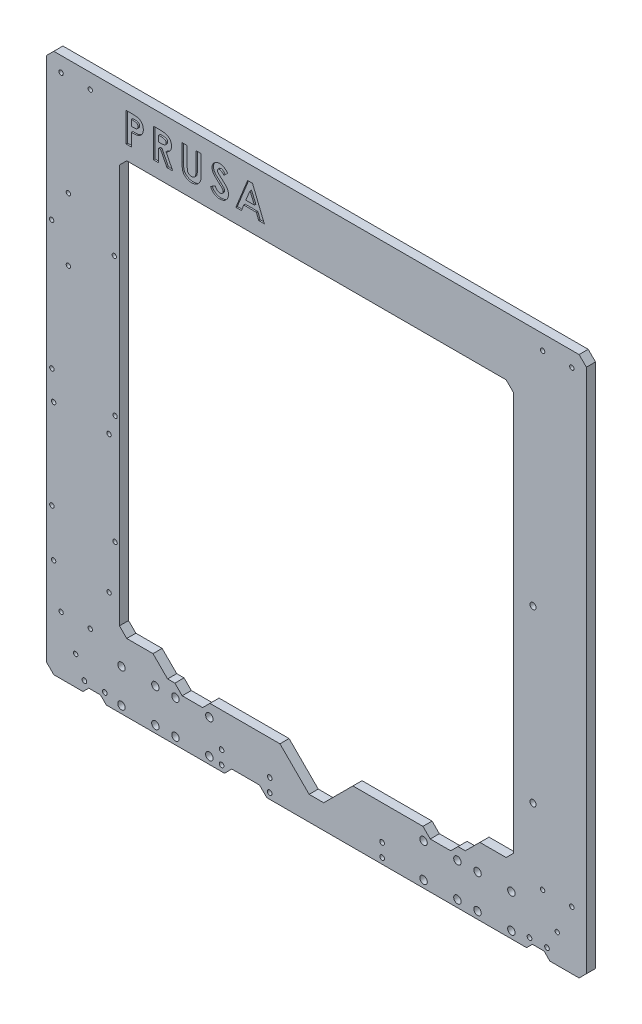
from build123d import *

# Parameters (mm, degrees)
SKETCH1_R           = 2.55
SKETCH1_R_2         = 1.5
SKETCH1_R_3         = 1.6
SKETCH1_R_4         = 2.1
BOSS_EXTRUDE1_DEPTH = 6.25
CUT_EXTRUDE1_DEPTH  = 1


with BuildPart() as part:
    # Sketch1 → Boss-Extrude1 (new body)
    with BuildSketch(Plane.XY):
        with BuildLine():
            add(Edge.make_bspline(
                [(5, 370), (2.5, 367.5), (0, 365)],
                knots=[1472.868668236, 1472.868668236, 1472.868668236, 1479.939736048, 1479.939736048, 1479.939736048], degree=2))
            add(Edge.make_bspline(
                [(0, 365), (0, 185), (0, 5)],
                knots=[0, 0, 0, 360.191742, 360.191742, 360.191742], degree=2))
            add(Edge.make_bspline(
                [(0, 5), (2.5, 2.5), (5, 0)],
                knots=[360.191742, 360.191742, 360.191742, 367.128552866, 367.128552866, 367.128552866], degree=2))
            add(Edge.make_bspline(
                [(5, 0), (15, 0), (25, 0)],
                knots=[367.128552866, 367.128552866, 367.128552866, 387.128552866, 387.128552866, 387.128552866], degree=2))
            add(Edge.make_bspline(
                [(25, 0), (27, 2), (29, 4)],
                knots=[387.128552866, 387.128552866, 387.128552866, 395.613834241, 395.613834241, 395.613834241], degree=2))
            add(Edge.make_bspline(
                [(29, 4), (33, 4), (37, 4)],
                knots=[395.613834241, 395.613834241, 395.613834241, 401.613834241, 401.613834241, 401.613834241], degree=2))
            add(Edge.make_bspline(
                [(37, 4), (39, 2), (41, 0)],
                knots=[401.613834241, 401.613834241, 401.613834241, 407.27068849, 407.27068849, 407.27068849], degree=2))
            add(Edge.make_bspline(
                [(41, 0), (81.5, 0), (122, 0)],
                knots=[407.27068849, 407.27068849, 407.27068849, 482.27068849, 482.27068849, 482.27068849], degree=2))
            add(Edge.make_bspline(
                [(122, 0), (124.5, 2.5), (127, 5)],
                knots=[482.27068849, 482.27068849, 482.27068849, 487.92754274, 487.92754274, 487.92754274], degree=2))
            add(Edge.make_bspline(
                [(127, 5), (136.5, 5), (146, 5)],
                knots=[487.92754274, 487.92754274, 487.92754274, 501.92754274, 501.92754274, 501.92754274], degree=2))
            add(Edge.make_bspline(
                [(146, 5), (148.5, 2.5), (151, 0)],
                knots=[501.92754274, 501.92754274, 501.92754274, 507.584396989, 507.584396989, 507.584396989], degree=2))
            add(Edge.make_bspline(
                [(151, 0), (240, 0), (329, 0)],
                knots=[507.584396989, 507.584396989, 507.584396989, 698.584396989, 698.584396989, 698.584396989], degree=2))
            add(Edge.make_bspline(
                [(329, 0), (331, 2), (333, 4)],
                knots=[698.584396989, 698.584396989, 698.584396989, 704.241251238, 704.241251238, 704.241251238], degree=2))
            add(Edge.make_bspline(
                [(333, 4), (337, 4), (341, 4)],
                knots=[704.241251238, 704.241251238, 704.241251238, 710.241251238, 710.241251238, 710.241251238], degree=2))
            add(Edge.make_bspline(
                [(341, 4), (343, 2), (345, 0)],
                knots=[710.241251238, 710.241251238, 710.241251238, 718.726532613, 718.726532613, 718.726532613], degree=2))
            add(Edge.make_bspline(
                [(345, 0), (355, 0), (365, 0)],
                knots=[718.726532613, 718.726532613, 718.726532613, 738.726532613, 738.726532613, 738.726532613], degree=2))
            add(Edge.make_bspline(
                [(365, 0), (367.5, 2.5), (370, 5)],
                knots=[738.726532613, 738.726532613, 738.726532613, 745.797600425, 745.797600425, 745.797600425], degree=2))
            add(Edge.make_bspline(
                [(370, 5), (370, 185), (370, 365)],
                knots=[745.797600425, 745.797600425, 745.797600425, 1105.797600425, 1105.797600425, 1105.797600425], degree=2))
            add(Edge.make_bspline(
                [(370, 365), (367.5, 367.5), (365, 370)],
                knots=[1105.797600425, 1105.797600425, 1105.797600425, 1112.868668236, 1112.868668236, 1112.868668236], degree=2))
            add(Edge.make_bspline(
                [(365, 370), (185, 370), (5, 370)],
                knots=[1112.868668236, 1112.868668236, 1112.868668236, 1472.868668236, 1472.868668236, 1472.868668236], degree=2))
        make_face()
        with Locations((318.6, 4.9)):
            Circle(SKETCH1_R, mode=Mode.SUBTRACT)
        with Locations((318.6, 28.1)):
            Circle(SKETCH1_R, mode=Mode.SUBTRACT)
        with Locations((295.4, 28.1)):
            Circle(SKETCH1_R, mode=Mode.SUBTRACT)
        with Locations((295.4, 4.9)):
            Circle(SKETCH1_R, mode=Mode.SUBTRACT)
        with Locations((281.6, 4.9)):
            Circle(SKETCH1_R, mode=Mode.SUBTRACT)
        with Locations((258.4, 4.9)):
            Circle(SKETCH1_R, mode=Mode.SUBTRACT)
        with Locations((258.4, 28.1)):
            Circle(SKETCH1_R, mode=Mode.SUBTRACT)
        with Locations((281.6, 28.1)):
            Circle(SKETCH1_R, mode=Mode.SUBTRACT)
        with Locations((111.6, 4.9)):
            Circle(SKETCH1_R, mode=Mode.SUBTRACT)
        with Locations((111.6, 28.1)):
            Circle(SKETCH1_R, mode=Mode.SUBTRACT)
        with Locations((88.4, 28.1)):
            Circle(SKETCH1_R, mode=Mode.SUBTRACT)
        with Locations((88.4, 4.9)):
            Circle(SKETCH1_R, mode=Mode.SUBTRACT)
        with Locations((74.6, 4.9)):
            Circle(SKETCH1_R, mode=Mode.SUBTRACT)
        with Locations((74.6, 28.1)):
            Circle(SKETCH1_R, mode=Mode.SUBTRACT)
        with Locations((51.4, 28.1)):
            Circle(SKETCH1_R, mode=Mode.SUBTRACT)
        with Locations((51.4, 4.9)):
            Circle(SKETCH1_R, mode=Mode.SUBTRACT)
        with Locations((360, 39.8)):
            Circle(SKETCH1_R_2, mode=Mode.SUBTRACT)
        with Locations((10, 39.8)):
            Circle(SKETCH1_R_2, mode=Mode.SUBTRACT)
        with Locations((340, 359.8)):
            Circle(SKETCH1_R_2, mode=Mode.SUBTRACT)
        with Locations((30, 39.8)):
            Circle(SKETCH1_R_2, mode=Mode.SUBTRACT)
        with Locations((42.9, 67.8)):
            Circle(SKETCH1_R_2, mode=Mode.SUBTRACT)
        with Locations((340, 39.8)):
            Circle(SKETCH1_R_2, mode=Mode.SUBTRACT)
        with Locations((10, 359.8)):
            Circle(SKETCH1_R_2, mode=Mode.SUBTRACT)
        with Locations((350, 19.8)):
            Circle(SKETCH1_R_2, mode=Mode.SUBTRACT)
        with Locations((47, 99.8)):
            Circle(SKETCH1_R_2, mode=Mode.SUBTRACT)
        with Locations((3.7, 181.1)):
            Circle(SKETCH1_R_2, mode=Mode.SUBTRACT)
        with Locations((20, 19.8)):
            Circle(SKETCH1_R_2, mode=Mode.SUBTRACT)
        with Locations((4.9, 67.8)):
            Circle(SKETCH1_R_2, mode=Mode.SUBTRACT)
        with Locations((360, 359.8)):
            Circle(SKETCH1_R_2, mode=Mode.SUBTRACT)
        with Locations((42.9, 161.8)):
            Circle(SKETCH1_R_2, mode=Mode.SUBTRACT)
        with Locations((3.7, 99.8)):
            Circle(SKETCH1_R_2, mode=Mode.SUBTRACT)
        with Locations((30, 359.8)):
            Circle(SKETCH1_R_2, mode=Mode.SUBTRACT)
        with Locations((47, 174.7)):
            Circle(SKETCH1_R_2, mode=Mode.SUBTRACT)
        with Locations((4.9, 161.8)):
            Circle(SKETCH1_R_2, mode=Mode.SUBTRACT)
        with Locations((46.5, 269.3)):
            Circle(SKETCH1_R_2, mode=Mode.SUBTRACT)
        with Locations((15, 247.8)):
            Circle(SKETCH1_R_2, mode=Mode.SUBTRACT)
        with Locations((3.5, 269.3)):
            Circle(SKETCH1_R_2, mode=Mode.SUBTRACT)
        with Locations((15, 290.8)):
            Circle(SKETCH1_R_2, mode=Mode.SUBTRACT)
        with Locations((40, 7)):
            Circle(SKETCH1_R_3, mode=Mode.SUBTRACT)
        with Locations((331, 7)):
            Circle(SKETCH1_R_3, mode=Mode.SUBTRACT)
        with Locations((343, 7)):
            Circle(SKETCH1_R_3, mode=Mode.SUBTRACT)
        with Locations((120, 13)):
            Circle(SKETCH1_R_3, mode=Mode.SUBTRACT)
        with Locations((120, 4)):
            Circle(SKETCH1_R_3, mode=Mode.SUBTRACT)
        with Locations((230, 13)):
            Circle(SKETCH1_R_3, mode=Mode.SUBTRACT)
        with Locations((230, 4)):
            Circle(SKETCH1_R_3, mode=Mode.SUBTRACT)
        with Locations((333.4, 205)):
            Circle(SKETCH1_R_4, mode=Mode.SUBTRACT)
        with Locations((333.4, 88)):
            Circle(SKETCH1_R_4, mode=Mode.SUBTRACT)
        with Locations((26, 7)):
            Circle(SKETCH1_R_3, mode=Mode.SUBTRACT)
        with Locations((153, 13)):
            Circle(SKETCH1_R_3, mode=Mode.SUBTRACT)
        with Locations((153, 4)):
            Circle(SKETCH1_R_3, mode=Mode.SUBTRACT)
        with BuildLine():
            add(Edge.make_bspline(
                [(93, 31.5), (100, 31.5), (107, 31.5)],
                knots=[1110.421356237, 1110.421356237, 1110.421356237, 1117.046356237, 1117.046356237, 1117.046356237], degree=2))
            add(Edge.make_bspline(
                [(107, 31.5), (109.5, 34), (112, 36.5)],
                knots=[0, 0, 0, 7.071067812, 7.071067812, 7.071067812], degree=2))
            add(Edge.make_bspline(
                [(112, 36.5), (134.25, 36.5), (156.5, 36.5), (158.25, 36.5), (160, 36.5)],
                knots=[7.071067812, 7.071067812, 7.071067812, 51.571067812, 51.571067812, 55.071067812, 55.071067812, 55.071067812], degree=2))
            add(Edge.make_bspline(
                [(160, 36.5), (170, 26.5), (180, 16.5)],
                knots=[55.071067812, 55.071067812, 55.071067812, 83.355339059, 83.355339059, 83.355339059], degree=2))
            add(Edge.make_bspline(
                [(180, 16.5), (185, 16.5), (190, 16.5)],
                knots=[83.355339059, 83.355339059, 83.355339059, 93.355339059, 93.355339059, 93.355339059], degree=2))
            add(Edge.make_bspline(
                [(190, 16.5), (200, 26.5), (210, 36.5)],
                knots=[93.355339059, 93.355339059, 93.355339059, 121.639610307, 121.639610307, 121.639610307], degree=2))
            add(Edge.make_bspline(
                [(210, 36.5), (211.75, 36.5), (213.5, 36.5), (235.75, 36.5), (258, 36.5)],
                knots=[121.639610307, 121.639610307, 121.639610307, 125.139610307, 125.139610307, 169.639610307, 169.639610307, 169.639610307], degree=2))
            add(Edge.make_bspline(
                [(258, 36.5), (260.5, 34), (263, 31.5)],
                knots=[169.639610307, 169.639610307, 169.639610307, 176.710678119, 176.710678119, 176.710678119], degree=2))
            add(Edge.make_bspline(
                [(263, 31.5), (264, 31.5), (265, 31.5), (270, 31.5), (275, 31.5), (276, 31.5), (277, 31.5)],
                knots=[176.710678119, 176.710678119, 176.710678119, 178.710678119, 178.710678119, 188.710678119, 188.710678119, 190.710678119, 190.710678119, 190.710678119], degree=2))
            add(Edge.make_bspline(
                [(277, 31.5), (279.5, 34), (282, 36.5)],
                knots=[190.710678119, 190.710678119, 190.710678119, 197.781745931, 197.781745931, 197.781745931], degree=2))
            add(Edge.make_bspline(
                [(282, 36.5), (284.5, 36.5), (287, 36.5)],
                knots=[197.781745931, 197.781745931, 197.781745931, 202.781745931, 202.781745931, 202.781745931], degree=2))
            add(Edge.make_bspline(
                [(287, 36.5), (292, 41.5), (297, 46.5)],
                knots=[202.781745931, 202.781745931, 202.781745931, 216.923881554, 216.923881554, 216.923881554], degree=2))
            add(Edge.make_bspline(
                [(297, 46.5), (306, 46.5), (315, 46.5)],
                knots=[216.923881554, 216.923881554, 216.923881554, 234.923881554, 234.923881554, 234.923881554], degree=2))
            add(Edge.make_bspline(
                [(315, 46.5), (317.5, 49), (320, 51.5)],
                knots=[234.923881554, 234.923881554, 234.923881554, 241.994949366, 241.994949366, 241.994949366], degree=2))
            add(Edge.make_bspline(
                [(320, 51.5), (320, 188.25), (320, 325)],
                knots=[241.994949366, 241.994949366, 241.994949366, 513.494949366, 513.494949366, 513.494949366], degree=2))
            add(Edge.make_bspline(
                [(320, 325), (317.5, 327.5), (315, 330)],
                knots=[513.494949366, 513.494949366, 513.494949366, 520.566017178, 520.566017178, 520.566017178], degree=2))
            add(Edge.make_bspline(
                [(315, 330), (185, 330), (55, 330)],
                knots=[520.566017178, 520.566017178, 520.566017178, 780.566017178, 780.566017178, 780.566017178], degree=2))
            add(Edge.make_bspline(
                [(55, 330), (52.5, 327.5), (50, 325)],
                knots=[780.566017178, 780.566017178, 780.566017178, 787.63708499, 787.63708499, 787.63708499], degree=2))
            add(Edge.make_bspline(
                [(50, 325), (50, 188.25), (50, 51.5)],
                knots=[787.63708499, 787.63708499, 787.63708499, 1059.13708499, 1059.13708499, 1059.13708499], degree=2))
            add(Edge.make_bspline(
                [(50, 51.5), (52.5, 49), (55, 46.5)],
                knots=[1059.13708499, 1059.13708499, 1059.13708499, 1066.208152802, 1066.208152802, 1066.208152802], degree=2))
            add(Edge.make_bspline(
                [(55, 46.5), (64, 46.5), (73, 46.5)],
                knots=[1066.208152802, 1066.208152802, 1066.208152802, 1084.208152802, 1084.208152802, 1084.208152802], degree=2))
            add(Edge.make_bspline(
                [(73, 46.5), (78, 41.5), (83, 36.5)],
                knots=[1084.208152802, 1084.208152802, 1084.208152802, 1098.350288425, 1098.350288425, 1098.350288425], degree=2))
            add(Edge.make_bspline(
                [(83, 36.5), (85.5, 36.5), (88, 36.5)],
                knots=[1098.350288425, 1098.350288425, 1098.350288425, 1103.350288425, 1103.350288425, 1103.350288425], degree=2))
            add(Edge.make_bspline(
                [(88, 36.5), (90.5, 34), (93, 31.5)],
                knots=[1103.350288425, 1103.350288425, 1103.350288425, 1110.421356237, 1110.421356237, 1110.421356237], degree=2))
        make_face(mode=Mode.SUBTRACT)
    extrude(amount=BOSS_EXTRUDE1_DEPTH)

    # Sketch2 → Cut-Extrude1 (cut)
    # profile 1 of 5: a face of its own
    with BuildSketch(Plane.XY.offset(6.25)):
        with BuildLine():
            Line((54.564407773, 359.746059065), (58.57081803, 359.746059065))
            add(Edge.make_bspline(
                [(58.57081803, 359.746059065), (58.832591679, 359.744887311), (59.337607918, 359.742626751), (60.065882885, 359.715214451), (60.7377522, 359.666089942), (61.353061503, 359.605379816), (61.911557793, 359.520266583), (62.413940476, 359.422690925), (62.860313807, 359.303815374), (63.25571131, 359.162711743), (63.610567798, 358.996356076), (63.946376486, 358.819175415), (64.255548063, 358.607716545), (64.553687352, 358.384769606), (64.823749214, 358.129036561), (65.082581726, 357.857536815), (65.319222626, 357.559502914), (65.534768419, 357.238542475), (65.730301665, 356.900585477), (65.901132591, 356.545027751), (66.039701071, 356.171306666), (66.155942795, 355.781839771), (66.249309281, 355.376644041), (66.311456986, 354.953227485), (66.353670833, 354.51454656), (66.357395623, 354.215980045), (66.359279568, 354.064969322)],
                knots=[0, 0, 0, 0, 1.698747864, 3.27724071, 4.728299578, 6.070144658, 7.288476769, 8.393259625, 9.389771311, 10.283485332, 11.113357557, 11.931608583, 12.74405601, 13.541433047, 14.344816069, 15.154114104, 15.974336324, 16.810834471, 17.661136416, 18.50621059, 19.367396281, 20.244825668, 21.142564693, 22.063065223, 23.020325768, 24, 24, 24, 24], degree=3))
            add(Edge.make_bspline(
                [(66.359279568, 354.064969322), (66.356553735, 353.897909754), (66.351197137, 353.569617176), (66.298685215, 353.088380532), (66.208978262, 352.629564962), (66.091735966, 352.189301194), (65.928249922, 351.774832541), (65.741474794, 351.376269654), (65.511682144, 351.004787013), (65.249107305, 350.655737818), (64.962345625, 350.326284134), (64.644589394, 350.025938314), (64.301895182, 349.752652909), (63.936246724, 349.503563869), (63.546271266, 349.27917366), (63.132250194, 349.077381106), (62.691356337, 348.904640161), (62.38433112, 348.814298045), (62.228670594, 348.768494963)],
                knots=[0, 0, 0, 0, 1.102006807, 2.165578795, 3.188629044, 4.184801286, 5.166646146, 6.124351954, 7.085497154, 8.042432466, 9.003981491, 9.963833307, 10.922997304, 11.89326795, 12.880200226, 13.889073926, 14.929769137, 16, 16, 16, 16], degree=3))
            add(Edge.make_bspline(
                [(62.228670594, 348.768494963), (62.126143617, 348.742986085), (61.90403717, 348.687725642), (61.536512005, 348.631622422), (61.112977841, 348.58003896), (60.632065114, 348.53570922), (60.093496568, 348.505575326), (59.497793676, 348.482042095), (58.844686477, 348.464931006), (58.390541557, 348.464323829), (58.154151363, 348.464007783)],
                knots=[0, 0, 0, 0, 0.618981996, 1.340914327, 2.176866532, 3.120127938, 4.170906482, 5.338178032, 6.614476169, 8, 8, 8, 8], degree=3))
            Line((58.154151363, 348.464007783), (58.154151363, 339.746059065))
            Line((58.154151363, 339.746059065), (54.564407773, 339.746059065))
            Line((54.564407773, 339.746059065), (54.564407773, 359.746059065))
        make_face()
        with BuildLine():
            Line((58.154151363, 352.053751373), (59.424183414, 352.053751373))
            add(Edge.make_bspline(
                [(59.424183414, 352.053751373), (59.655285797, 352.055216742), (60.080517614, 352.057913041), (60.661234114, 352.096903103), (61.127909063, 352.156448804), (61.496590939, 352.241851109), (61.787700201, 352.371460415), (62.038763713, 352.521393976), (62.254107297, 352.710980848), (62.440563146, 352.927616288), (62.589628978, 353.176541267), (62.692998368, 353.453702524), (62.760145092, 353.753276605), (62.766346715, 353.961760337), (62.769535979, 354.068975732)],
                knots=[0, 0, 0, 0, 1.8619151, 3.425951444, 4.686033666, 5.651700536, 6.461346321, 7.243864085, 7.999046032, 8.762387399, 9.539336099, 10.322741239, 11.137448474, 12, 12, 12, 12], degree=3))
            add(Edge.make_bspline(
                [(62.769535979, 354.068975732), (62.766379521, 354.162648427), (62.760255235, 354.344395977), (62.71526456, 354.606702771), (62.643562367, 354.851226815), (62.539668645, 355.075414379), (62.405358664, 355.278884532), (62.241607617, 355.46155712), (62.050516752, 355.62734423), (61.902983431, 355.71509788), (61.828029568, 355.75968086)],
                knots=[0, 0, 0, 0, 1.102301479, 2.1387299, 3.123554645, 4.094223062, 5.036071848, 5.982632524, 6.975082478, 8, 8, 8, 8], degree=3))
            add(Edge.make_bspline(
                [(61.828029568, 355.75968086), (61.76453932, 355.791789699), (61.630117453, 355.859770692), (61.401183982, 355.938803566), (61.136998252, 356.005476502), (60.835776712, 356.060814395), (60.498721021, 356.103762347), (60.125891316, 356.136606786), (59.716738942, 356.149814814), (59.432197947, 356.154088822), (59.283959055, 356.156315476)],
                knots=[0, 0, 0, 0, 0.656809284, 1.390599849, 2.23162475, 3.173112763, 4.218524733, 5.370385145, 6.63003504, 8, 8, 8, 8], degree=3))
            Line((59.283959055, 356.156315476), (58.154151363, 356.156315476))
            Line((58.154151363, 356.156315476), (58.154151363, 352.053751373))
        make_face(mode=Mode.SUBTRACT)
    # profile 2 of 5: a face of its own
    with BuildSketch(Plane.XY.offset(6.25)):
        with BuildLine():
            Line((73.333638543, 359.746059065), (77.51633085, 359.746059065))
            add(Edge.make_bspline(
                [(77.51633085, 359.746059065), (77.792805539, 359.745077739), (78.324544243, 359.743190372), (79.091282412, 359.713412716), (79.795636864, 359.671974665), (80.438650459, 359.608739098), (81.020048106, 359.52489638), (81.5404125, 359.42605969), (81.999728433, 359.313414092), (82.4018696, 359.173048789), (82.764782117, 359.014718855), (83.103067038, 358.832794858), (83.424187431, 358.629302579), (83.725996952, 358.398887586), (84.011118397, 358.145694986), (84.280089666, 357.869469917), (84.529109945, 357.567870105), (84.756637289, 357.242801277), (84.964010149, 356.900836323), (85.147284264, 356.541505726), (85.296323078, 356.164559592), (85.428014848, 355.77544561), (85.522868163, 355.368601318), (85.588837256, 354.947987415), (85.637137245, 354.512123294), (85.639914263, 354.216016563), (85.64133085, 354.064969322)],
                knots=[0, 0, 0, 0, 1.749336639, 3.364467119, 4.854658419, 6.213483162, 7.451590619, 8.570285859, 9.5643256, 10.440900261, 11.26203566, 12.067320669, 12.869050712, 13.665104639, 14.467235401, 15.27997916, 16.102287765, 16.939272006, 17.78853747, 18.631303466, 19.488103222, 20.351255419, 21.228522269, 22.127379805, 23.044756219, 24, 24, 24, 24], degree=3))
            add(Edge.make_bspline(
                [(85.64133085, 354.064969322), (85.637651066, 353.907310701), (85.630435681, 353.598170881), (85.591569689, 353.144069699), (85.520534866, 352.70961745), (85.412942291, 352.296086159), (85.289278601, 351.898328945), (85.124837616, 351.523684678), (84.939249711, 351.166704701), (84.718832378, 350.832438629), (84.476935124, 350.513461746), (84.195613706, 350.22199524), (83.89309343, 349.94237389), (83.552368531, 349.692112227), (83.188458477, 349.454288463), (82.794132761, 349.238756799), (82.371964885, 349.040099263), (82.075159962, 348.929314099), (81.923382132, 348.872661629)],
                knots=[0, 0, 0, 0, 1.099860209, 2.156625411, 3.176576793, 4.16617041, 5.135385252, 6.078461593, 7.016046972, 7.938469504, 8.868247731, 9.803980173, 10.76021508, 11.73834243, 12.748633912, 13.790971185, 14.870363756, 16, 16, 16, 16], degree=3))
            Line((81.923382132, 348.872661629), (86.538766748, 339.746059065))
            Line((86.538766748, 339.746059065), (82.548382132, 339.746059065))
            Line((82.548382132, 339.746059065), (78.14133085, 348.464007783))
            Line((78.14133085, 348.464007783), (76.923382132, 348.464007783))
            Line((76.923382132, 348.464007783), (76.923382132, 339.746059065))
            Line((76.923382132, 339.746059065), (73.333638543, 339.746059065))
            Line((73.333638543, 339.746059065), (73.333638543, 359.746059065))
        make_face()
        with BuildLine():
            Line((76.923382132, 352.053751373), (78.321619312, 352.053751373))
            add(Edge.make_bspline(
                [(78.321619312, 352.053751373), (78.49256543, 352.055676683), (78.819890514, 352.059363238), (79.290626977, 352.076463009), (79.718167949, 352.117665007), (80.104349437, 352.169722191), (80.451114671, 352.229829728), (80.755370626, 352.315967477), (81.021805424, 352.408266257), (81.2472618, 352.522969697), (81.439886548, 352.653412386), (81.606205689, 352.801598525), (81.743775466, 352.973105111), (81.857002409, 353.163271335), (81.945080661, 353.373779172), (82.009371037, 353.602317722), (82.04529985, 353.851490333), (82.049433583, 354.023453362), (82.051587261, 354.113046245)],
                knots=[0, 0, 0, 0, 1.688639943, 3.233382647, 4.650958383, 5.928841754, 7.082724185, 8.122798841, 9.049171256, 9.863274652, 10.613301712, 11.341792392, 12.054588806, 12.776240173, 13.521029143, 14.301969904, 15.115324896, 16, 16, 16, 16], degree=3))
            add(Edge.make_bspline(
                [(82.051587261, 354.113046245), (82.047515535, 354.219041166), (82.039517385, 354.427248546), (81.960150885, 354.726994166), (81.833816561, 355.004429246), (81.660646805, 355.258300265), (81.442562011, 355.480861125), (81.192292504, 355.677050296), (80.904436863, 355.832182013), (80.637904201, 355.934505241), (80.395421778, 355.995726285), (80.176589042, 356.041347665), (79.923179415, 356.073680846), (79.635001589, 356.10797594), (79.312790137, 356.130214573), (78.954788815, 356.146444342), (78.5620258, 356.153084738), (78.288232676, 356.155207556), (78.145337261, 356.156315476)],
                knots=[0, 0, 0, 0, 1.020303359, 2.004196876, 2.966617323, 3.9489082, 4.950758222, 5.960522915, 7.003732012, 8.091992268, 8.70421221, 9.413913587, 10.24622431, 11.166358409, 12.212345909, 13.359657661, 14.621978493, 16, 16, 16, 16], degree=3))
            Line((78.145337261, 356.156315476), (76.923382132, 356.156315476))
            Line((76.923382132, 356.156315476), (76.923382132, 352.053751373))
        make_face(mode=Mode.SUBTRACT)
    # profile 3 of 5: a face of its own
    with BuildSketch(Plane.XY.offset(6.25)):
        with BuildLine():
            Line((92.872100081, 359.746059065), (96.461843671, 359.746059065))
            Line((96.461843671, 359.746059065), (96.461843671, 346.733238553))
            add(Edge.make_bspline(
                [(96.461843671, 346.733238553), (96.462038863, 346.598327274), (96.462415876, 346.337747532), (96.481289313, 345.963900918), (96.498559809, 345.620257604), (96.529720687, 345.307193807), (96.575755984, 345.024575609), (96.620333172, 344.770587571), (96.680663989, 344.549777061), (96.771331561, 344.298436892), (96.911020527, 344.016042484), (97.139264545, 343.721724553), (97.402638617, 343.453116723), (97.718307612, 343.229537742), (98.073091645, 343.048682498), (98.465041336, 342.914688777), (98.893604176, 342.84020606), (99.189931871, 342.828834909), (99.342452645, 342.822982142)],
                knots=[0, 0, 0, 0, 1.155499968, 2.231836252, 3.205919964, 4.102923608, 4.924856345, 5.658536265, 6.31071849, 6.882491295, 7.94666036, 8.992281882, 10.060072772, 11.158554251, 12.289267114, 13.461410017, 14.693379945, 16, 16, 16, 16], degree=3))
            add(Edge.make_bspline(
                [(99.342452645, 342.822982142), (99.504487146, 342.827710426), (99.820426989, 342.836929779), (100.274856156, 342.927427711), (100.695887356, 343.071531411), (101.074605924, 343.277204116), (101.410634973, 343.523738898), (101.695076521, 343.804865807), (101.919556746, 344.12114555), (102.065864605, 344.412937697), (102.148009263, 344.681506959), (102.209580776, 344.921463403), (102.254719507, 345.204588255), (102.295670846, 345.52645991), (102.320279447, 345.890412337), (102.346963463, 346.293518585), (102.356743402, 346.738536815), (102.358410321, 347.04841136), (102.359279568, 347.210001373)],
                knots=[0, 0, 0, 0, 1.261321664, 2.459363699, 3.594844139, 4.716940403, 5.803436589, 6.833651888, 7.818396249, 8.814403945, 9.360733334, 10.004355033, 10.743453831, 11.592799886, 12.532235708, 13.585170094, 14.740740724, 16, 16, 16, 16], degree=3))
            Line((102.359279568, 347.210001373), (102.359279568, 359.746059065))
            Line((102.359279568, 359.746059065), (105.949023158, 359.746059065))
            Line((105.949023158, 359.746059065), (105.949023158, 347.814969322))
            add(Edge.make_bspline(
                [(105.949023158, 347.814969322), (105.948524657, 347.573246014), (105.947566088, 347.108435667), (105.932845357, 346.440470489), (105.901507583, 345.830391445), (105.875187467, 345.278020272), (105.82424903, 344.784101105), (105.771183129, 344.346524768), (105.703546072, 343.966841933), (105.602906198, 343.534619167), (105.429231569, 343.036930481), (105.149245299, 342.463863533), (104.793820852, 341.902796279), (104.373726917, 341.359900846), (103.899402437, 340.855568484), (103.381364202, 340.41282995), (102.827842551, 340.038320892), (102.233053579, 339.741198508), (101.597503483, 339.509465448), (100.914903968, 339.353752504), (100.185720513, 339.248550884), (99.682059719, 339.238444974), (99.42258085, 339.233238553)],
                knots=[0, 0, 0, 0, 1.170808336, 2.251350247, 3.235597562, 4.129743112, 4.929140599, 5.639994148, 6.264258765, 6.79612947, 7.788252245, 8.809469599, 9.879094798, 10.999557536, 12.129761673, 13.226370002, 14.293821979, 15.358369427, 16.438775801, 17.562147481, 18.744053101, 20, 20, 20, 20], degree=3))
            add(Edge.make_bspline(
                [(99.42258085, 339.233238553), (99.250177928, 339.236142452), (98.910030499, 339.241871786), (98.409784033, 339.292389548), (97.926197556, 339.366833734), (97.460179723, 339.475440135), (97.010113075, 339.61573932), (96.576117182, 339.788437846), (96.15980488, 339.992572422), (95.763505792, 340.226265453), (95.387707599, 340.478964236), (95.044247449, 340.759091475), (94.721306072, 341.045930702), (94.428213109, 341.351553329), (94.162767172, 341.672750841), (93.925514947, 342.010251176), (93.716808911, 342.364024355), (93.531399179, 342.74044712), (93.372706544, 343.158651682), (93.238922692, 343.633513747), (93.12204597, 344.172476306), (93.035190086, 344.776753612), (92.956446032, 345.444354034), (92.906605388, 346.177016774), (92.880531503, 346.974762852), (92.874981571, 347.52782367), (92.872100081, 347.814969322)],
                knots=[0, 0, 0, 0, 1.001158378, 1.975264943, 2.917723546, 3.841610987, 4.75185031, 5.653588123, 6.552117133, 7.442167995, 8.324307438, 9.179605724, 10.014504199, 10.831958861, 11.636465792, 12.43274043, 13.225645099, 14.020104002, 14.867201867, 15.819789774, 16.883317127, 18.068162734, 19.364263498, 20.787406516, 22.332041935, 24, 24, 24, 24], degree=3))
            Line((92.872100081, 347.814969322), (92.872100081, 359.746059065))
        make_face()
    # profile 4 of 5: a face of its own
    with BuildSketch(Plane.XY.offset(6.25)):
        with BuildLine():
            Line((124.205433414, 357.073783424), (121.521138543, 354.617853937))
            add(Edge.make_bspline(
                [(121.521138543, 354.617853937), (121.40615486, 354.780050375), (121.185402225, 355.091444916), (120.827585229, 355.508409547), (120.47138396, 355.864111406), (120.11349843, 356.157064538), (119.750756478, 356.385489032), (119.383787771, 356.547216098), (119.014672757, 356.650027528), (118.766684445, 356.662830025), (118.644535979, 356.669135988)],
                knots=[0, 0, 0, 0, 1.299362458, 2.494594718, 3.587462134, 4.587049575, 5.512617175, 6.380583204, 7.202344345, 8, 8, 8, 8], degree=3))
            add(Edge.make_bspline(
                [(118.644535979, 356.669135988), (118.530599392, 356.66514024), (118.310617779, 356.657425501), (117.997017669, 356.580741564), (117.718599026, 356.448396351), (117.475633573, 356.275343851), (117.283169087, 356.066855708), (117.129501121, 355.848205253), (117.042973143, 355.6068646), (117.031584359, 355.441102103), (117.025946235, 355.359039835)],
                knots=[0, 0, 0, 0, 1.185010067, 2.2879431, 3.333075148, 4.379039566, 5.372662701, 6.27520591, 7.14612461, 8, 8, 8, 8], degree=3))
            add(Edge.make_bspline(
                [(117.025946235, 355.359039835), (117.029479361, 355.275794191), (117.036594587, 355.108149035), (117.10531798, 354.862444179), (117.208903757, 354.622361933), (117.307884196, 354.476212446), (117.358478286, 354.401507783)],
                knots=[0, 0, 0, 0, 0.967525499, 1.948461899, 2.951351359, 4, 4, 4, 4], degree=3))
            add(Edge.make_bspline(
                [(117.358478286, 354.401507783), (117.404473787, 354.343440631), (117.510349355, 354.209777715), (117.712232379, 353.998076491), (117.965755057, 353.738723962), (118.280673478, 353.4406385), (118.64391451, 353.093099786), (119.072314845, 352.709769701), (119.553543253, 352.278776956), (119.895589256, 351.978649215), (120.07482444, 351.821379578)],
                knots=[0, 0, 0, 0, 0.473873513, 1.090794244, 1.870441696, 2.795289791, 3.865433203, 5.087734844, 6.473946851, 8, 8, 8, 8], degree=3))
            add(Edge.make_bspline(
                [(120.07482444, 351.821379578), (120.243062443, 351.675778073), (120.562343219, 351.399456666), (121.016616361, 351.007262794), (121.415846794, 350.654415531), (121.765850394, 350.346210358), (122.06132145, 350.079413498), (122.303502121, 349.852749665), (122.495350235, 349.670631587), (122.604404654, 349.560632157), (122.650946235, 349.513687271)],
                knots=[0, 0, 0, 0, 1.543621617, 2.929473131, 4.163658386, 5.240097082, 6.164993805, 6.925417477, 7.541396219, 8, 8, 8, 8], degree=3))
            add(Edge.make_bspline(
                [(122.650946235, 349.513687271), (122.827515289, 349.322601738), (123.16694302, 348.955268239), (123.608079413, 348.38601684), (123.971148934, 347.830311401), (124.2520264, 347.277695424), (124.46415636, 346.72019576), (124.613710792, 346.14413976), (124.703279936, 345.543508), (124.713224202, 345.133650147), (124.718253927, 344.926347527)],
                knots=[0, 0, 0, 0, 1.206664779, 2.319633467, 3.337109185, 4.282041471, 5.190008762, 6.099243693, 7.03861361, 8, 8, 8, 8], degree=3))
            add(Edge.make_bspline(
                [(124.718253927, 344.926347527), (124.714673898, 344.724356547), (124.707649746, 344.328042728), (124.621617359, 343.748096486), (124.498940226, 343.193062762), (124.309259855, 342.668981108), (124.078078544, 342.167248884), (123.78825938, 341.695681482), (123.447906513, 341.249506447), (123.057809868, 340.836699704), (122.626316657, 340.462106197), (122.16349918, 340.128634209), (121.664831774, 339.853310607), (121.134574976, 339.626601259), (120.573012619, 339.451986688), (119.980813694, 339.322930246), (119.357072392, 339.245472604), (118.930549102, 339.237375326), (118.712644953, 339.233238553)],
                knots=[0, 0, 0, 0, 1.043214005, 2.046824704, 3.02475056, 3.976699089, 4.921714032, 5.875962561, 6.831408892, 7.817874052, 8.806269674, 9.781291748, 10.760897367, 11.74438705, 12.757449933, 13.795994037, 14.874007457, 16, 16, 16, 16], degree=3))
            add(Edge.make_bspline(
                [(118.712644953, 339.233238553), (118.541592051, 339.236273145), (118.202809207, 339.242283378), (117.703494513, 339.291351931), (117.221349732, 339.370543354), (116.756917956, 339.48404832), (116.308106838, 339.627874506), (115.874897947, 339.803552683), (115.460281867, 340.013805797), (115.061121416, 340.254310207), (114.679357007, 340.533567507), (114.310161379, 340.845868373), (113.957201733, 341.196016133), (113.618782876, 341.583182699), (113.297070106, 342.008464436), (112.98153261, 342.465938507), (112.686193823, 342.96409501), (112.503749917, 343.313555827), (112.41056162, 343.492052655)],
                knots=[0, 0, 0, 0, 1.016823716, 2.013894106, 2.979844003, 3.91962641, 4.853723003, 5.779685073, 6.695824784, 7.614987388, 8.547259901, 9.504950863, 10.487499108, 11.500346958, 12.559593716, 13.656357062, 14.802919212, 16, 16, 16, 16], degree=3))
            Line((112.41056162, 343.492052655), (115.567612902, 345.387084706))
            add(Edge.make_bspline(
                [(115.567612902, 345.387084706), (115.684177534, 345.184467485), (115.907641896, 344.796032954), (116.286323149, 344.274121931), (116.67426276, 343.827191532), (117.080429546, 343.46314128), (117.49988467, 343.177103356), (117.934654199, 342.972680811), (118.385043593, 342.846143487), (118.691828387, 342.830690357), (118.844856491, 342.822982142)],
                knots=[0, 0, 0, 0, 1.283663364, 2.460892379, 3.537111102, 4.529833553, 5.449777664, 6.316464042, 7.160231139, 8, 8, 8, 8], degree=3))
            add(Edge.make_bspline(
                [(118.844856491, 342.822982142), (119.000507982, 342.829277089), (119.302494545, 342.841490201), (119.733541718, 342.954299042), (120.128742088, 343.131417198), (120.470350369, 343.384140382), (120.759602723, 343.675821348), (120.973087564, 344.000329759), (121.10720018, 344.351440026), (121.121379136, 344.595344313), (121.128510338, 344.718014194)],
                knots=[0, 0, 0, 0, 1.13588714, 2.203786484, 3.234766741, 4.283437687, 5.291419208, 6.222934724, 7.106237994, 8, 8, 8, 8], degree=3))
            add(Edge.make_bspline(
                [(121.128510338, 344.718014194), (121.121924964, 344.832138555), (121.108547409, 345.063971271), (121.010012462, 345.408669239), (120.855972284, 345.753210446), (120.673731891, 346.035812465), (120.488279472, 346.272427476), (120.31094513, 346.477443678), (120.094998813, 346.703950691), (119.840988064, 346.952233441), (119.552269029, 347.224477626), (119.228598499, 347.520656586), (118.866270104, 347.838161338), (118.610175679, 348.054442438), (118.476266748, 348.167533424)],
                knots=[0, 0, 0, 0, 0.916159276, 1.861089862, 2.860218735, 3.940849679, 4.552606315, 5.27541173, 6.11797699, 7.06649574, 8.129236253, 9.306560635, 10.591630461, 12, 12, 12, 12], degree=3))
            add(Edge.make_bspline(
                [(118.476266748, 348.167533424), (118.22170054, 348.382920847), (117.733110935, 348.796314505), (117.042671836, 349.406883923), (116.420524386, 349.97751699), (115.872042119, 350.515267979), (115.390236523, 351.010205874), (114.978370595, 351.466350751), (114.640968869, 351.887221143), (114.285926305, 352.385713958), (113.948564884, 352.993161706), (113.65698888, 353.723991766), (113.467826676, 354.454729094), (113.446633682, 354.945305887), (113.436202645, 355.186764194)],
                knots=[0, 0, 0, 0, 1.345494975, 2.582412109, 3.71882943, 4.751509156, 5.681369928, 6.505683931, 7.230279997, 7.856715994, 8.973648664, 10.023341002, 11.027102913, 12, 12, 12, 12], degree=3))
            add(Edge.make_bspline(
                [(113.436202645, 355.186764194), (113.440540899, 355.357993464), (113.449087726, 355.695333521), (113.52532674, 356.191342922), (113.639268849, 356.669950318), (113.804745505, 357.129409531), (114.019514223, 357.569145069), (114.280342489, 357.991309624), (114.591280472, 358.392017687), (114.941686586, 358.771003618), (115.327744411, 359.117353631), (115.740296257, 359.423042221), (116.177007046, 359.68123125), (116.635205201, 359.895417797), (117.117729986, 360.059363992), (117.621026662, 360.175577227), (118.145817118, 360.244697153), (118.502768258, 360.254093205), (118.684600081, 360.258879578)],
                knots=[0, 0, 0, 0, 1.010766082, 1.991317756, 2.957454644, 3.913069143, 4.869106762, 5.843196583, 6.838735724, 7.860187025, 8.887984031, 9.89767229, 10.887916223, 11.879572884, 12.879850636, 13.892031539, 14.926195476, 16, 16, 16, 16], degree=3))
            add(Edge.make_bspline(
                [(118.684600081, 360.258879578), (118.920245125, 360.25025918), (119.389675112, 360.233086431), (120.083740888, 360.098801145), (120.761675319, 359.887623387), (121.307967589, 359.632860657), (121.742642151, 359.386071879), (122.075779599, 359.158859859), (122.414764883, 358.898576279), (122.762331711, 358.604400916), (123.112021751, 358.27079112), (123.473778365, 357.905688734), (123.842672176, 357.505938421), (124.082394664, 357.220358651), (124.205433414, 357.073783424)],
                knots=[0, 0, 0, 0, 1.282922637, 2.555718331, 3.837320111, 5.142675274, 5.830281639, 6.55870424, 7.337177975, 8.157850921, 9.037902056, 9.96903443, 10.957596896, 12, 12, 12, 12], degree=3))
        make_face()
    # profile 5 of 5: a face of its own
    with BuildSketch(Plane.XY.offset(6.25)):
        Polygon((137.850465466, 359.746059065), (141.179792389, 359.746059065), (149.256715466, 339.746059065), (145.42258085, 339.746059065), (143.868093671, 343.848623168), (135.154151363, 343.848623168), (133.599664184, 339.746059065), (129.769535979, 339.746059065), align=None)
        Polygon((139.513125722, 354.381475732), (136.51633085, 347.438366758), (142.509920594, 347.438366758), align=None, mode=Mode.SUBTRACT)
    extrude(amount=-CUT_EXTRUDE1_DEPTH, mode=Mode.SUBTRACT)


solid = part.part
